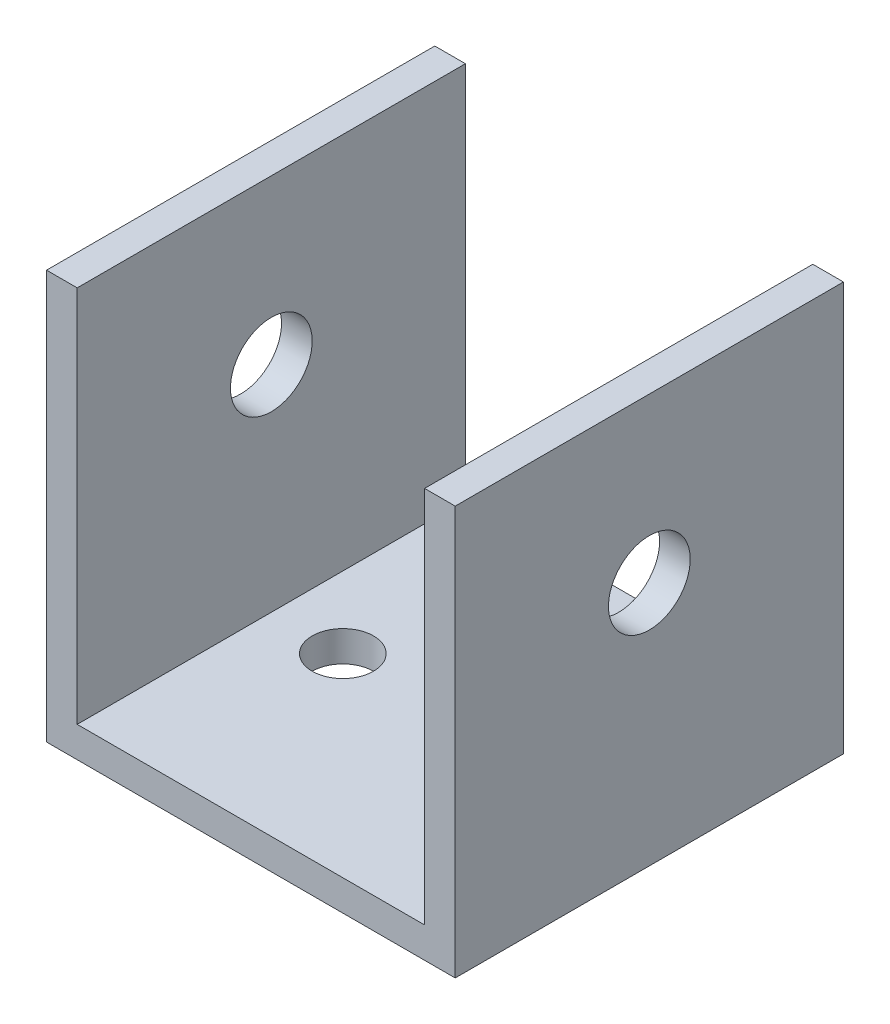
from build123d import *

# Parameters (mm, degrees)
EXTRUSION1_DEPTH = 19
ESQUISSE2_R      = 1.5
EXTRUSION2_DEPTH = 5
ESQUISSE3_R      = 2
EXTRUSION3_DEPTH = 47.241826523


with BuildPart() as part:
    # Esquisse1 → Extrusion1 (new body)
    with BuildSketch(Plane.XY):
        Polygon((18.706066256, -17.112080516), (18.706066256, -37.112080516), (38.706066256, -37.112080516), (38.706066256, -17.112080516), (37.206066256, -17.112080516), (37.206066256, -35.612080516), (20.206066256, -35.612080516), (20.206066256, -17.112080516), align=None)
    extrude(amount=EXTRUSION1_DEPTH)

    # Esquisse2 → Extrusion2 (cut)
    with BuildSketch(Plane.XZ.offset(37.112080516)):
        with Locations(Location((23.706066256, 9.5, 0), (0, 0, 270))):
            Circle(ESQUISSE2_R)
        with Locations(Location((33.706066256, 9.5, 0), (0, 0, 270))):
            Circle(ESQUISSE2_R)
    extrude(amount=-EXTRUSION2_DEPTH, mode=Mode.SUBTRACT)

    # Esquisse3 → Extrusion3 (cut, through all)
    with BuildSketch(Plane.ZY.offset(-18.706066256)):
        with Locations(Location((9.5, -25.112080516, 0), (0, 0, 270))):
            Circle(ESQUISSE3_R)
    extrude(amount=-EXTRUSION3_DEPTH, mode=Mode.SUBTRACT)


solid = part.part
